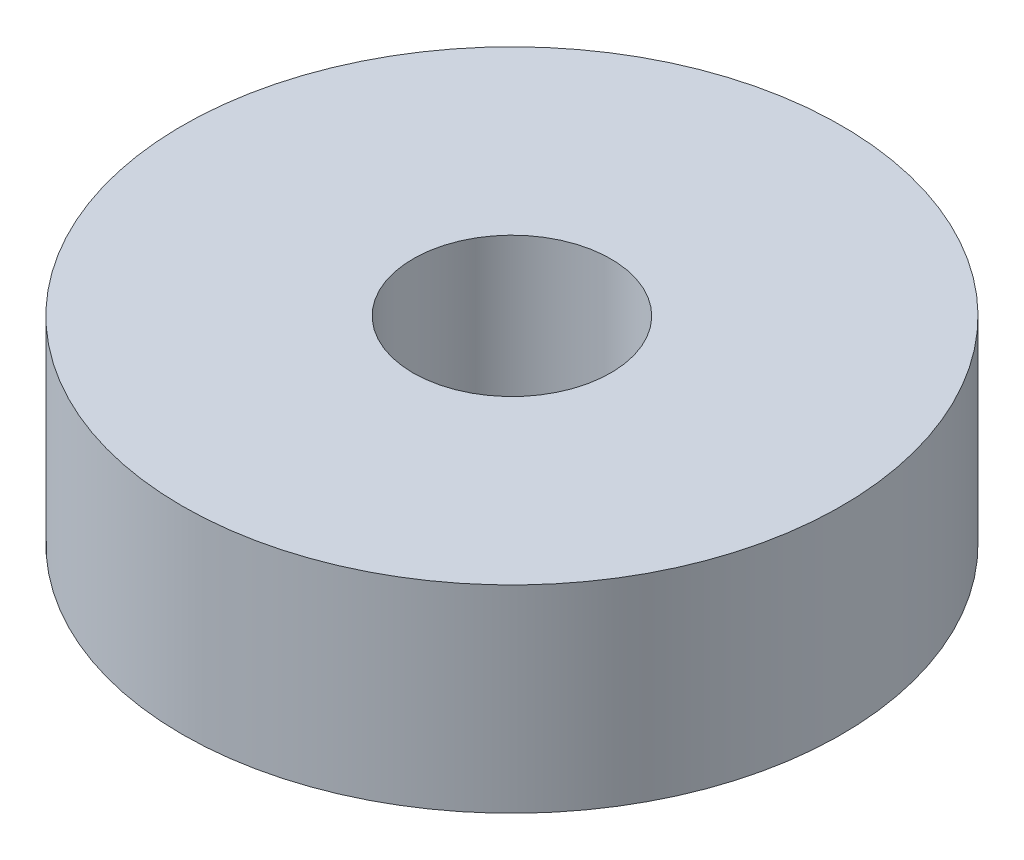
from build123d import *

# Parameters (mm, degrees)
SKETCH_1_R      = 10
SKETCH_1_R_2    = 3
EXTRUDE_1_DEPTH = 6


with BuildPart() as part:
    # 草图1 → 凸台-拉伸1 (new body)
    with BuildSketch(Plane(origin=(0, 0, 0), x_dir=(1, 0, 0), z_dir=(0, 1, 0))):
        with Locations(Location((0, 0, 0), (0, 0, 270))):
            Circle(SKETCH_1_R)
        with Locations(Location((0, 0, 0), (0, 0, 270))):
            Circle(SKETCH_1_R_2, mode=Mode.SUBTRACT)
    extrude(amount=EXTRUDE_1_DEPTH)


solid = part.part
